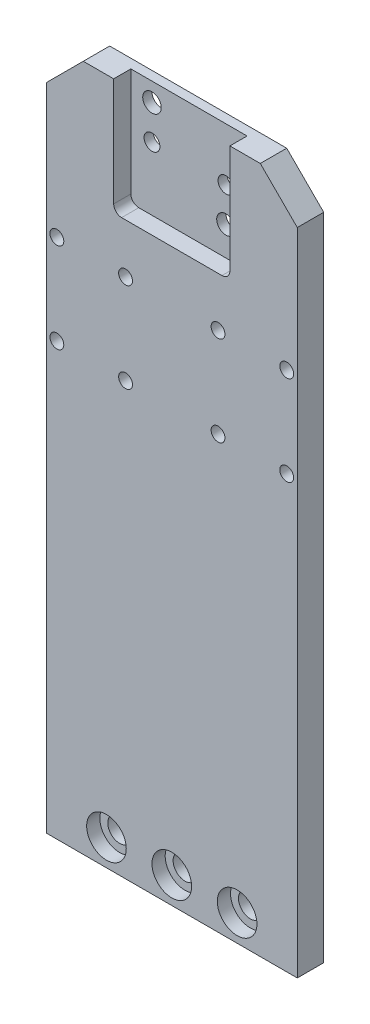
from build123d import *

# Parameters (mm, degrees)
SCHIZZO1_R                                           = 4.2
SCHIZZO1_R_2                                         = 2.61831532
ESTRUSIONE_ESTRUSIONE1_DEPTH                         = 10
TAGLIO_ESTRUSIONE1_DEPTH                             = 6.5
SCHIZZO3_R                                           = 3.5
SCHIZZO3_R_2                                         = 3
TAGLIO_ESTRUSIONE2_DEPTH                             = 6.5
FORO_LAMATO_PER_VITE_M8_A_TESTA_CILINDRI_D           = 9
FORO_LAMATO_PER_VITE_M8_A_TESTA_CILINDRI_CBORE_D     = 15
FORO_LAMATO_PER_VITE_M8_A_TESTA_CILINDRI_CBORE_DEPTH = 5


with BuildPart() as part:
    # Schizzo1 → Estrusione-Estrusione1 (new body)
    with BuildSketch(Plane.XY):
        Polygon((0, 0), (95, 0), (95, 246), (81, 260), (14, 260), (0, 246), align=None)
        with Locations((22.770722004, 10)):
            Circle(SCHIZZO1_R, mode=Mode.SUBTRACT)
        with Locations((47.5, 10)):
            Circle(SCHIZZO1_R, mode=Mode.SUBTRACT)
        with Locations(Location((72.229277996, 10, 0), (0, 0, 180))):
            Circle(SCHIZZO1_R, mode=Mode.SUBTRACT)
        with Locations((4, 163.3)):
            Circle(SCHIZZO1_R_2, mode=Mode.SUBTRACT)
        with Locations((30, 163.3)):
            Circle(SCHIZZO1_R_2, mode=Mode.SUBTRACT)
        with Locations(Location((65, 163.3, 0), (0, 0, 180))):
            Circle(SCHIZZO1_R_2, mode=Mode.SUBTRACT)
        with Locations(Location((91, 163.3, 0), (0, 0, 180))):
            Circle(SCHIZZO1_R_2, mode=Mode.SUBTRACT)
        with Locations((91, 197.3)):
            Circle(SCHIZZO1_R_2, mode=Mode.SUBTRACT)
        with Locations((65, 197.3)):
            Circle(SCHIZZO1_R_2, mode=Mode.SUBTRACT)
        with Locations(Location((30, 197.3, 0), (0, 0, 180))):
            Circle(SCHIZZO1_R_2, mode=Mode.SUBTRACT)
        with Locations(Location((4, 197.3, 0), (0, 0, 180))):
            Circle(SCHIZZO1_R_2, mode=Mode.SUBTRACT)
    extrude(amount=-ESTRUSIONE_ESTRUSIONE1_DEPTH)

    # Schizzo2 → Taglio-Estrusione1 (cut)
    with BuildSketch(Plane.XY):
        with BuildLine():
            Line((25.504353305, 260), (25.504353305, 219))
            ThreePointArc((25.504353305, 219), (26.383032962, 216.878679656), (28.504353305, 216))
            Line((28.504353305, 216), (66.495646695, 216))
            ThreePointArc((66.495646695, 216), (68.616967038, 216.878679656), (69.495646695, 219))
            Line((69.495646695, 219), (69.495646695, 260))
            Line((69.495646695, 260), (25.504353305, 260))
        make_face()
    extrude(amount=-TAGLIO_ESTRUSIONE1_DEPTH, mode=Mode.SUBTRACT)

    # Schizzo3 → Taglio-Estrusione2 (cut)
    with BuildSketch(Plane.XY.offset(-6.5)):
        with Locations((33.5, 253)):
            Circle(SCHIZZO3_R)
        with Locations((33.5, 240)):
            Circle(SCHIZZO3_R_2)
        with Locations((61.5, 240)):
            Circle(SCHIZZO3_R_2)
        with Locations((61.5, 227)):
            Circle(SCHIZZO3_R)
    extrude(amount=-TAGLIO_ESTRUSIONE2_DEPTH, mode=Mode.SUBTRACT)

    # Foro lamato per Vite M8 a testa cilindrica piana-1 (through all)
    with Locations(Plane(origin=(47.5, 10, 0), x_dir=(1, 0, 0), z_dir=(0, 0, 1))):
        with Locations((0, 0), (-24.729277996, 0), (24.729277996, 0)):
            CounterBoreHole(FORO_LAMATO_PER_VITE_M8_A_TESTA_CILINDRI_D / 2, FORO_LAMATO_PER_VITE_M8_A_TESTA_CILINDRI_CBORE_D / 2, FORO_LAMATO_PER_VITE_M8_A_TESTA_CILINDRI_CBORE_DEPTH)


solid = part.part
